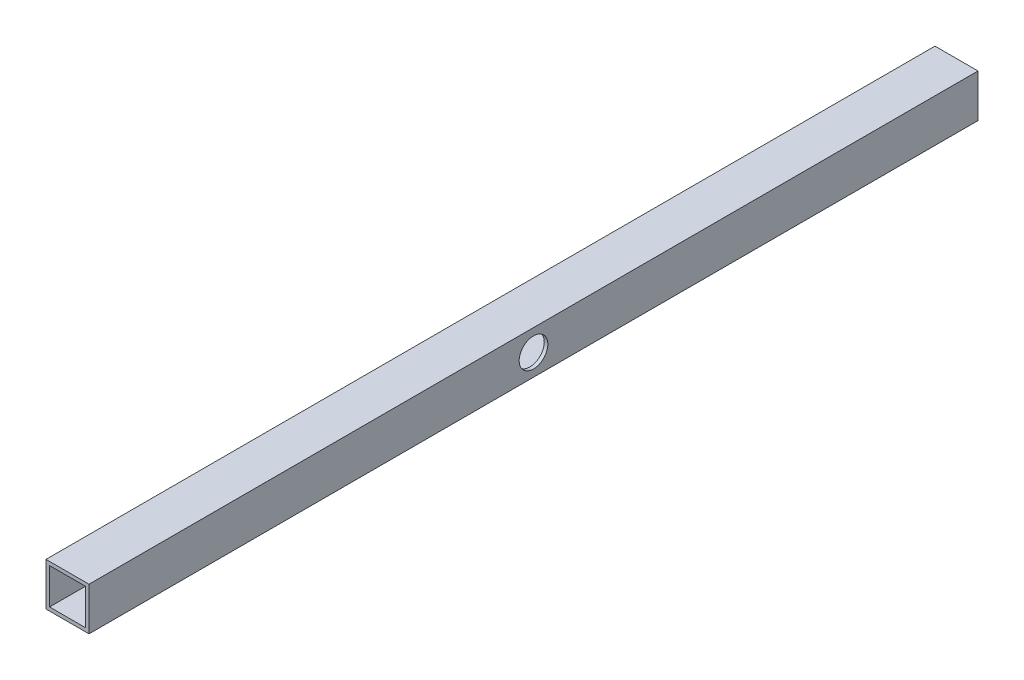
from build123d import *

# Parameters (mm, degrees)
SKETCH1_W               = 19.05
SKETCH1_H               = 19.05
SKETCH1_W_2             = 15.875
SKETCH1_H_2             = 15.875
BOSS_EXTRUDE1_DEPTH     = 196.85
CUT_EXTRUDE1_DEPTH      = 198.310348816
CUT_EXTRUDE1_DEPTH_BACK = 198.310348816
SKETCH2_R               = 6.35


with BuildPart() as part:
    # Sketch1 → Boss-Extrude1 (new, symmetric)
    with BuildSketch(Plane.XY):
        Rectangle(SKETCH1_W, SKETCH1_H)
        Rectangle(SKETCH1_W_2, SKETCH1_H_2, mode=Mode.SUBTRACT)
    extrude(amount=BOSS_EXTRUDE1_DEPTH, both=True)

    # Sketch2 → Cut-Extrude1 (cut, two sides: drawn at the far end of the back side and taken through both)
    with BuildSketch(Plane(origin=(0, 0, 0), x_dir=(0, 0, -1), z_dir=(1, 0, 0)).offset(-CUT_EXTRUDE1_DEPTH_BACK)):
        Circle(SKETCH2_R)
    extrude(amount=CUT_EXTRUDE1_DEPTH + CUT_EXTRUDE1_DEPTH_BACK, mode=Mode.SUBTRACT)


solid = part.part
